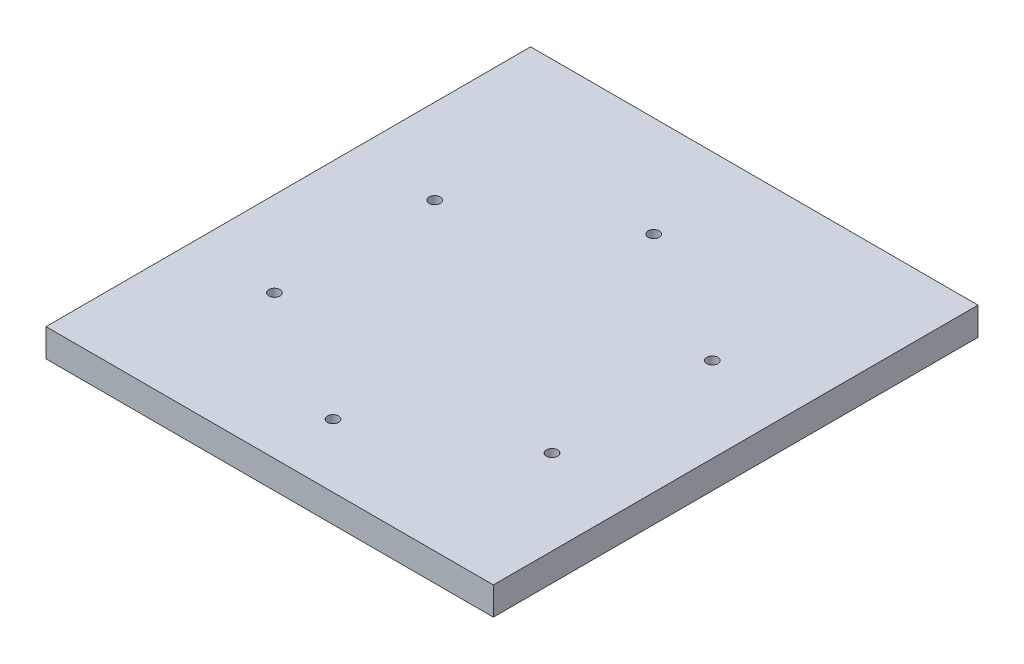
from build123d import *

# Parameters (mm, degrees)
CROQUIS1_W              = 240
CROQUIS1_H              = 220
CROQUIS1_R              = 3
SALIENTE_EXTRUIR1_DEPTH = 15
CROQUIS2_W              = 240
CROQUIS2_H              = 40
SALIENTE_EXTRUIR2_DEPTH = 15


with BuildPart() as part:
    # Croquis1 → Saliente-Extruir1 (new body)
    with BuildSketch(Plane(origin=(0, 0, 0), x_dir=(1, 0, 0), z_dir=(0, 1, 0))):
        Rectangle(CROQUIS1_W, CROQUIS1_H)
        with Locations(Location((0, 96, 0), (0, 0, 270))):
            Circle(CROQUIS1_R, mode=Mode.SUBTRACT)
        with Locations(Location((0, -76, 0), (0, 0, 270))):
            Circle(CROQUIS1_R, mode=Mode.SUBTRACT)
        with Locations(Location((-74.47818473, 53, 0), (0, 0, 270))):
            Circle(CROQUIS1_R, mode=Mode.SUBTRACT)
        with Locations(Location((-74.47818473, -33, 0), (0, 0, 270))):
            Circle(CROQUIS1_R, mode=Mode.SUBTRACT)
        with Locations(Location((74.47818473, 53, 0), (0, 0, 270))):
            Circle(CROQUIS1_R, mode=Mode.SUBTRACT)
        with Locations(Location((74.47818473, -33, 0), (0, 0, 270))):
            Circle(CROQUIS1_R, mode=Mode.SUBTRACT)
    extrude(amount=SALIENTE_EXTRUIR1_DEPTH)

    # Croquis2 → Saliente-Extruir2 (add)
    with BuildSketch(Plane(origin=(0, 15, 0), x_dir=(1, 0, 0), z_dir=(0, 1, 0))):
        with Locations((0, 130)):
            Rectangle(CROQUIS2_W, CROQUIS2_H)
    extrude(amount=-SALIENTE_EXTRUIR2_DEPTH)


solid = part.part
